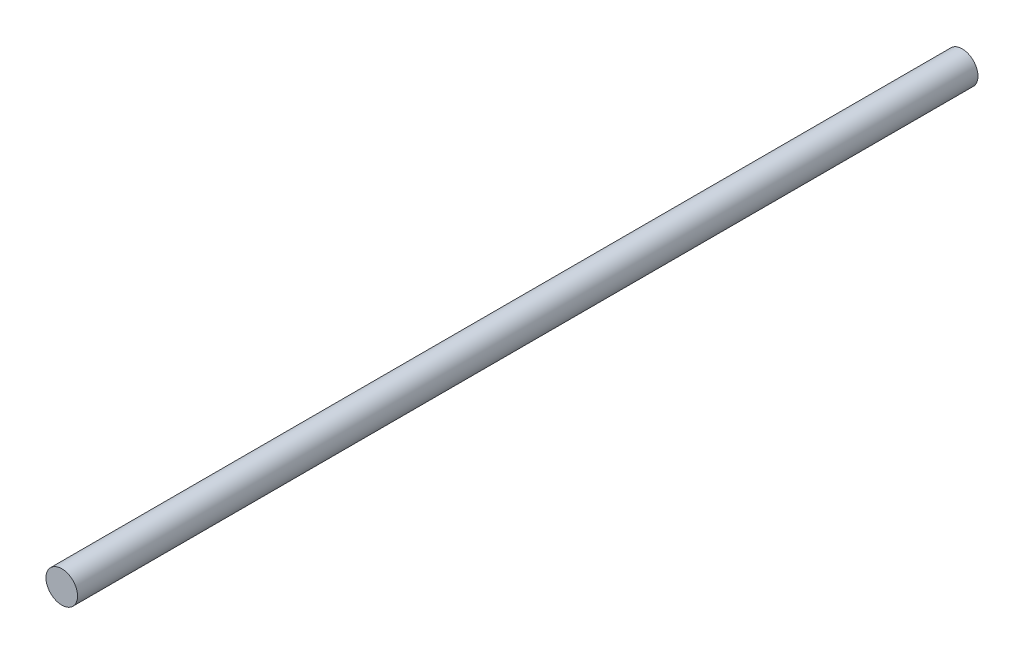
from build123d import *

# Parameters (mm, degrees)
SKETCH1_R           = 10
BOSS_EXTRUDE1_DEPTH = 570


with BuildPart() as part:
    # Sketch1 → Boss-Extrude1 (new body)
    with BuildSketch(Plane.XY):
        Circle(SKETCH1_R)
    extrude(amount=BOSS_EXTRUDE1_DEPTH)


solid = part.part
